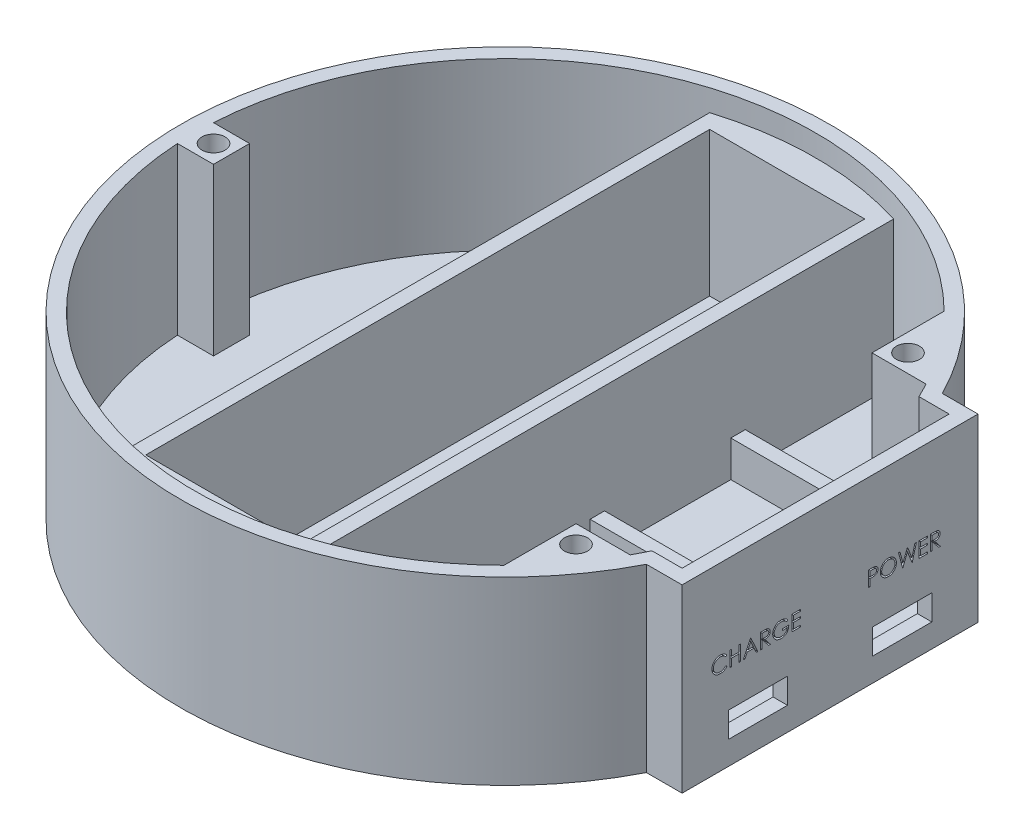
from build123d import *

# Parameters (mm, degrees)
BODY_DEPTH          = 25
SHELL1_T            = -2
SKETCH2_W           = 21.5
SKETCH2_H           = 78.132514876
BATTERY_CASE_DEPTH  = 20
USB_HOLE_REACH      = 105.682
SKETCH3_W           = 8.2
SKETCH3_H           = 3.5
SKETCH4_W           = 30.25
SKETCH4_H           = 2
PCB_PLACE_DEPTH     = 5
SKETCH5_R           = 1.6
FIXATION_HOLE_DEPTH = 23
CUT_EXTRUDE2_DEPTH  = 1


with BuildPart() as part:
    # Sketch1 → Body (new body)
    with BuildSketch(Plane(origin=(0, 0, 0), x_dir=(1, 0, 0), z_dir=(0, 1, 0))):
        with BuildLine():
            Line((40.059330998, 20.5), (45, 20.5))
            Line((45, 20.5), (45, -20.5))
            Line((45, -20.5), (40.059330998, -20.5))
            ThreePointArc((40.059330998, -20.5), (-45, 0), (40.059330998, 20.5))
        make_face()
    extrude(amount=BODY_DEPTH)

    # Shell1
    shell1_openings = [part.faces().sort_by_distance(p)[0] for p in [
        (0.446771334, 25, 0),
    ]]
    offset(amount=SHELL1_T, openings=shell1_openings, kind=Kind.INTERSECTION)

    # Sketch2 → Battery_Case (add)
    with BuildSketch(Plane(origin=(0, 2, 0), x_dir=(1, 0, 0), z_dir=(0, 1, 0))):
        with BuildLine():
            Line((-12.75, -41.066257438), (-12.75, 41.066257438))
            ThreePointArc((-12.75, 41.066257438), (0, 43), (12.75, 41.066257438))
            Line((12.75, 41.066257438), (12.75, -41.066257438))
            ThreePointArc((12.75, -41.066257438), (0, -43), (-12.75, -41.066257438))
        make_face()
        Rectangle(SKETCH2_W, SKETCH2_H, mode=Mode.SUBTRACT)
    extrude(amount=BATTERY_CASE_DEPTH)

    # Sketch3 → USB_Hole (cut, up to next)
    with BuildSketch(Plane(origin=(45, 0, 0), x_dir=(0, 0, -1), z_dir=(1, 0, 0)), mode=Mode.PRIVATE) as usb_hole_sk1:
        with Locations((-10, 5)):
            Rectangle(SKETCH3_W, SKETCH3_H)
    usb_hole_tool1 = extrude(usb_hole_sk1.sketch, amount=-USB_HOLE_REACH, mode=Mode.PRIVATE) & part.part
    # Sketch3 → USB_Hole (cut, up to next)
    with BuildSketch(Plane(origin=(45, 0, 0), x_dir=(0, 0, -1), z_dir=(1, 0, 0)), mode=Mode.PRIVATE) as usb_hole_sk2:
        with Locations((10, 5)):
            Rectangle(SKETCH3_W, SKETCH3_H)
    usb_hole_tool2 = extrude(usb_hole_sk2.sketch, amount=-USB_HOLE_REACH, mode=Mode.PRIVATE) & part.part
    add(usb_hole_tool1.solids().sort_by_distance((45, 5, 10))[0], mode=Mode.SUBTRACT)
    add(usb_hole_tool2.solids().sort_by_distance((45, 5, -10))[0], mode=Mode.SUBTRACT)

    # Sketch4 → PCB_Place (add)
    with BuildSketch(Plane(origin=(0, 2, 0), x_dir=(1, 0, 0), z_dir=(0, 1, 0))):
        with BuildLine():
            Line((38.816877772, 18.5), (12.75, 18.5))
            Line((12.75, 18.5), (12.75, 20.5))
            Line((12.75, 20.5), (37.798809505, 20.5))
            ThreePointArc((37.798809505, 20.5), (38.320893573, 19.506642862), (38.816877772, 18.5))
        make_face()
        with BuildLine():
            Line((38.816877772, -18.5), (12.75, -18.5))
            Line((12.75, -18.5), (12.75, -20.5))
            Line((12.75, -20.5), (37.798809505, -20.5))
            ThreePointArc((37.798809505, -20.5), (38.320893573, -19.506642862), (38.816877772, -18.5))
        make_face()
        with Locations((27.875, 0)):
            Rectangle(SKETCH4_W, SKETCH4_H)
    extrude(amount=PCB_PLACE_DEPTH)

    # Sketch5 → Fixation_Hole (add)
    # profile 1 of 3: a face of its own
    with BuildSketch(Plane(origin=(0, 2, 0), x_dir=(1, 0, 0), z_dir=(0, 1, 0))):
        with BuildLine():
            Line((-42.927264064, 2.5), (-37.927264064, 2.5))
            Line((-37.927264064, 2.5), (-37.927264064, -2.5))
            Line((-37.927264064, -2.5), (-42.927264064, -2.5))
            ThreePointArc((-42.927264064, -2.5), (-43, 0), (-42.927264064, 2.5))
        make_face()
        with Locations(Location((-40.427264064, 0, 0), (0, 0, 270))):
            Circle(SKETCH5_R, mode=Mode.SUBTRACT)
    # profile 2 of 3: a face of its own
    with BuildSketch(Plane(origin=(0, 2, 0), x_dir=(1, 0, 0), z_dir=(0, 1, 0))):
        with BuildLine():
            Line((37.798809505, 20.5), (30.310889132, 20.5))
            Line((30.310889132, 20.5), (30.310889132, 30.5))
            ThreePointArc((30.310889132, 30.5), (34.419947155, 25.773382352), (37.798809505, 20.5))
        make_face()
        with Locations(Location((32.798809505, 23, 0), (0, 0, 270))):
            Circle(SKETCH5_R, mode=Mode.SUBTRACT)
    # profile 3 of 3: a face of its own
    with BuildSketch(Plane(origin=(0, 2, 0), x_dir=(1, 0, 0), z_dir=(0, 1, 0))):
        with BuildLine():
            Line((37.798809505, -20.5), (30.310889132, -20.5))
            Line((30.310889132, -20.5), (30.310889132, -30.5))
            ThreePointArc((30.310889132, -30.5), (34.419947155, -25.773382352), (37.798809505, -20.5))
        make_face()
        with Locations(Location((32.798809505, -23, 0), (0, 0, 270))):
            Circle(SKETCH5_R, mode=Mode.SUBTRACT)
    extrude(amount=FIXATION_HOLE_DEPTH)

    # Sketch6 → Cut-Extrude2 (cut)
    # profile 1 of 11: a face of its own
    with BuildSketch(Plane(origin=(45, 0, 0), x_dir=(0, 0, -1), z_dir=(1, 0, 0))):
        with BuildLine():
            Line((-14.293376068, 13.478271902), (-14.459588675, 13.351068376))
            add(Edge.make_bspline(
                [(-14.459588675, 13.351068376), (-14.47144557, 13.365199224), (-14.494999502, 13.393270407), (-14.5328934, 13.432688512), (-14.572385346, 13.469618456), (-14.613460243, 13.504236164), (-14.656857425, 13.535331065), (-14.701525623, 13.56452359), (-14.748212059, 13.590690269), (-14.812771442, 13.622417885), (-14.89722514, 13.655526274), (-15.003539162, 13.683286799), (-15.114519684, 13.700958653), (-15.190234423, 13.702872629), (-15.228745994, 13.703846154)],
                knots=[0, 0, 0, 0, 0.757959112, 1.505699292, 2.245454638, 2.979532153, 3.711538275, 4.438200793, 5.171680507, 5.909471876, 7.393775596, 8.890124382, 10.418191784, 12, 12, 12, 12], degree=3))
            add(Edge.make_bspline(
                [(-15.228745994, 13.703846154), (-15.249963037, 13.703601853), (-15.292200208, 13.703115518), (-15.354882856, 13.696699523), (-15.416395035, 13.687681791), (-15.476696731, 13.674301239), (-15.535711187, 13.657384464), (-15.593824211, 13.637170047), (-15.650194431, 13.612160215), (-15.705601651, 13.584517601), (-15.758687174, 13.553295289), (-15.808915703, 13.519239119), (-15.856104046, 13.48273019), (-15.90028953, 13.443631663), (-15.941517327, 13.402119621), (-15.979488701, 13.357751662), (-16.014072259, 13.310669633), (-16.045953507, 13.261494382), (-16.07450597, 13.210369146), (-16.098412135, 13.157104698), (-16.119581899, 13.102613169), (-16.136333346, 13.046278896), (-16.149592459, 12.988498271), (-16.158741093, 12.929116223), (-16.165084121, 12.868256807), (-16.165568037, 12.827006413), (-16.165811966, 12.806213275)],
                knots=[0, 0, 0, 0, 1.054917814, 2.100044995, 3.131103042, 4.146048494, 5.169673617, 6.183595914, 7.203665975, 8.234915748, 9.262203917, 10.264457458, 11.251630812, 12.227803204, 13.197192746, 14.159520551, 15.12972552, 16.100847026, 17.073214652, 18.039054194, 19.002613845, 19.979014051, 20.95965708, 21.949030935, 22.966165397, 24, 24, 24, 24], degree=3))
            add(Edge.make_bspline(
                [(-16.165811966, 12.806213275), (-16.165048866, 12.774928143), (-16.16355062, 12.713503937), (-16.150216627, 12.623533139), (-16.129954025, 12.537342065), (-16.099585557, 12.455469494), (-16.062139274, 12.376905868), (-16.014822332, 12.302980466), (-15.960020903, 12.232576162), (-15.896959706, 12.167356856), (-15.827771427, 12.107779508), (-15.753538166, 12.055316061), (-15.674444811, 12.011582775), (-15.591364659, 11.975190655), (-15.50365839, 11.947216348), (-15.411483724, 11.927522807), (-15.315041136, 11.914676345), (-15.249140594, 11.913446448), (-15.215601629, 11.912820513)],
                knots=[0, 0, 0, 0, 1.029171465, 2.020641659, 2.987623507, 3.938342917, 4.889210282, 5.84687017, 6.821220943, 7.821438502, 8.827599549, 9.822697543, 10.807740252, 11.797342354, 12.80366471, 13.83203677, 14.896651826, 16, 16, 16, 16], degree=3))
            add(Edge.make_bspline(
                [(-15.215601629, 11.912820513), (-15.178649051, 11.913841822), (-15.105917536, 11.915852004), (-14.999256873, 11.932881645), (-14.897151433, 11.960493815), (-14.799595726, 11.999136844), (-14.706864774, 12.049371566), (-14.61881346, 12.110269806), (-14.535367463, 12.182410845), (-14.485189592, 12.237494451), (-14.459588675, 12.265598291)],
                knots=[0, 0, 0, 0, 1.028121516, 2.023589091, 2.998037872, 3.967518031, 4.937445131, 5.927275754, 6.942489185, 8, 8, 8, 8], degree=3))
            Line((-14.459588675, 12.265598291), (-14.293376068, 12.1396668))
            add(Edge.make_bspline(
                [(-14.293376068, 12.1396668), (-14.306752259, 12.122407832), (-14.333440568, 12.087972564), (-14.376655654, 12.039427292), (-14.422180496, 11.993765328), (-14.470353235, 11.951354814), (-14.520619709, 11.911347113), (-14.573882488, 11.874878863), (-14.62944138, 11.841441042), (-14.687108136, 11.810823807), (-14.746821487, 11.783659567), (-14.808509884, 11.760404193), (-14.871907422, 11.740371522), (-14.937017001, 11.723890589), (-15.003973673, 11.711026648), (-15.072535817, 11.70242713), (-15.142851408, 11.696535591), (-15.190289791, 11.695998614), (-15.214329594, 11.695726496)],
                knots=[0, 0, 0, 0, 0.986787822, 1.968848986, 2.935600012, 3.899624008, 4.868462664, 5.837806735, 6.815139263, 7.798259679, 8.787526145, 9.778297419, 10.776456485, 11.791383307, 12.812564526, 13.85620153, 14.913611965, 16, 16, 16, 16], degree=3))
            add(Edge.make_bspline(
                [(-15.214329594, 11.695726496), (-15.23709505, 11.695884939), (-15.28211092, 11.69619824), (-15.348573498, 11.701273504), (-15.413276721, 11.708197868), (-15.476035661, 11.718624043), (-15.537192798, 11.730927525), (-15.596193723, 11.747420142), (-15.653619017, 11.765895114), (-15.709237966, 11.787609082), (-15.76309788, 11.812111726), (-15.815025042, 11.839804716), (-15.86499557, 11.870455177), (-15.913500753, 11.903387493), (-15.959824054, 11.93965948), (-16.0043669, 11.978767397), (-16.047379064, 12.020579433), (-16.073990212, 12.050729749), (-16.087369792, 12.065888755)],
                knots=[0, 0, 0, 0, 1.114604814, 2.203992996, 3.262667896, 4.300477797, 5.318619304, 6.316056647, 7.298880507, 8.271930387, 9.238335007, 10.195173496, 11.151986948, 12.108099108, 13.064862484, 14.031167946, 15.010108607, 16, 16, 16, 16], degree=3))
            add(Edge.make_bspline(
                [(-16.087369792, 12.065888755), (-16.108799919, 12.092220808), (-16.15140145, 12.144567009), (-16.20590603, 12.229406626), (-16.252561933, 12.317985019), (-16.290284513, 12.410767547), (-16.319774357, 12.507546015), (-16.340203937, 12.608369207), (-16.353479431, 12.713142962), (-16.354997558, 12.784406163), (-16.355769231, 12.820629674)],
                knots=[0, 0, 0, 0, 0.994628077, 1.977248131, 2.950237994, 3.925870899, 4.908910175, 5.911660606, 6.938484602, 8, 8, 8, 8], degree=3))
            add(Edge.make_bspline(
                [(-16.355769231, 12.820629674), (-16.354828709, 12.858702734), (-16.352978291, 12.933609103), (-16.337257024, 13.043539065), (-16.311966609, 13.148859197), (-16.276045634, 13.24937289), (-16.230503826, 13.345608821), (-16.174244874, 13.436831836), (-16.107922364, 13.523625329), (-16.032056454, 13.604672345), (-15.94886097, 13.678779477), (-15.859768164, 13.743976562), (-15.764952415, 13.798234298), (-15.665458286, 13.84358912), (-15.560540755, 13.878450296), (-15.450423669, 13.902854366), (-15.335313945, 13.918044241), (-15.256778097, 13.919964486), (-15.216873665, 13.920940171)],
                knots=[0, 0, 0, 0, 1.032925535, 2.032216505, 3.007276963, 3.968222605, 4.92396291, 5.891752235, 6.871517503, 7.883894988, 8.900124299, 9.891468569, 10.874487609, 11.85992873, 12.854644235, 13.869047385, 14.917252991, 16, 16, 16, 16], degree=3))
            add(Edge.make_bspline(
                [(-15.216873665, 13.920940171), (-15.192553484, 13.920648592), (-15.144414136, 13.920071441), (-15.073201817, 13.914443441), (-15.003870505, 13.905061403), (-14.936372435, 13.892291208), (-14.870379234, 13.876442019), (-14.806395279, 13.855795267), (-14.74404512, 13.83218746), (-14.68372199, 13.804998292), (-14.625715315, 13.77447793), (-14.57004316, 13.740964672), (-14.517147746, 13.704500065), (-14.466656871, 13.66539424), (-14.419415162, 13.622819873), (-14.374081315, 13.577947994), (-14.332194854, 13.52948611), (-14.30633935, 13.495374555), (-14.293376068, 13.478271902)],
                knots=[0, 0, 0, 0, 1.096760587, 2.17092713, 3.219439832, 4.250915756, 5.268269357, 6.278326846, 7.281116186, 8.274029601, 9.260640565, 10.235837813, 11.203064059, 12.156899882, 13.114053108, 14.069676657, 15.032185724, 16, 16, 16, 16], degree=3))
        make_face()
    # profile 2 of 11: a face of its own
    with BuildSketch(Plane(origin=(45, 0, 0), x_dir=(0, 0, -1), z_dir=(1, 0, 0))):
        Polygon((-13.859188034, 13.866666667), (-13.669230769, 13.866666667), (-13.669230769, 12.998290598), (-12.583760684, 12.998290598), (-12.583760684, 13.866666667), (-12.393803419, 13.866666667), (-12.393803419, 11.75), (-12.583760684, 11.75), (-12.583760684, 12.781196581), (-13.669230769, 12.781196581), (-13.669230769, 11.75), (-13.859188034, 11.75), align=None)
    # profile 3 of 11: a face of its own
    with BuildSketch(Plane(origin=(45, 0, 0), x_dir=(0, 0, -1), z_dir=(1, 0, 0))):
        Polygon((-10.982692308, 13.866666667), (-10.005769231, 11.75), (-10.212262954, 11.75), (-10.525183627, 12.428418803), (-11.484722222, 12.428418803), (-11.806547142, 11.75), (-12.013888889, 11.75), (-11.00982906, 13.866666667), align=None)
        Polygon((-10.998380743, 13.454103232), (-11.381687366, 12.645512821), (-10.625250401, 12.645512821), align=None, mode=Mode.SUBTRACT)
    # profile 4 of 11: a face of its own
    with BuildSketch(Plane(origin=(45, 0, 0), x_dir=(0, 0, -1), z_dir=(1, 0, 0))):
        with BuildLine():
            Line((-9.625854701, 13.866666667), (-9.20226696, 13.866666667))
            add(Edge.make_bspline(
                [(-9.20226696, 13.866666667), (-9.173999707, 13.866572574), (-9.119723448, 13.866391906), (-9.041967232, 13.865384516), (-8.971314654, 13.862497168), (-8.907802656, 13.860012453), (-8.851432403, 13.855481612), (-8.802031041, 13.851151126), (-8.7598261, 13.845482293), (-8.734277419, 13.840217585), (-8.722709669, 13.837833868)],
                knots=[0, 0, 0, 0, 1.410062039, 2.707475311, 3.878576406, 4.937260626, 5.877586885, 6.699081471, 7.410979367, 8, 8, 8, 8], degree=3))
            add(Edge.make_bspline(
                [(-8.722709669, 13.837833868), (-8.707223758, 13.834007681), (-8.676582293, 13.82643693), (-8.632464872, 13.810435172), (-8.590425257, 13.791917589), (-8.550638078, 13.770168101), (-8.513302623, 13.745025258), (-8.47803393, 13.716923108), (-8.44467196, 13.686015417), (-8.414565926, 13.651522918), (-8.386178976, 13.615336076), (-8.362237283, 13.576205709), (-8.341598888, 13.535286595), (-8.325167194, 13.492162585), (-8.311936229, 13.447251894), (-8.302607027, 13.400147717), (-8.297012261, 13.351064651), (-8.296442663, 13.317586297), (-8.296153846, 13.300610978)],
                knots=[0, 0, 0, 0, 1.027469482, 2.033020251, 3.019912614, 3.986113645, 4.951240523, 5.91722682, 6.890402269, 7.87763091, 8.8651537, 9.85103654, 10.82876324, 11.815024772, 12.821070561, 13.842952187, 14.906261191, 16, 16, 16, 16], degree=3))
            add(Edge.make_bspline(
                [(-8.296153846, 13.300610978), (-8.29704224, 13.272407843), (-8.298775727, 13.217376222), (-8.314938052, 13.137510832), (-8.341412423, 13.063010628), (-8.37789365, 12.993969413), (-8.424351143, 12.931732975), (-8.480185659, 12.877068271), (-8.545428348, 12.831324134), (-8.606164173, 12.799602676), (-8.659815141, 12.779286964), (-8.703982906, 12.764992595), (-8.752162459, 12.753948454), (-8.803892181, 12.744054469), (-8.859387344, 12.736584635), (-8.918514939, 12.7311136), (-8.981317136, 12.727694246), (-9.024460287, 12.727185034), (-9.046654647, 12.726923077)],
                knots=[0, 0, 0, 0, 1.260483769, 2.459530307, 3.627416485, 4.787058657, 5.939039949, 7.08810263, 8.267026773, 9.491475466, 10.141966685, 10.831826277, 11.566392101, 12.351337768, 13.187381173, 14.07005841, 15.007169909, 16, 16, 16, 16], degree=3))
            Line((-9.046654647, 12.726923077), (-8.269017094, 11.75))
            Line((-8.269017094, 11.75), (-8.503919605, 11.75))
            Line((-8.503919605, 11.75), (-9.281557158, 12.726923077))
            Line((-9.281557158, 12.726923077), (-9.435897436, 12.726923077))
            Line((-9.435897436, 12.726923077), (-9.435897436, 11.75))
            Line((-9.435897436, 11.75), (-9.625854701, 11.75))
            Line((-9.625854701, 11.75), (-9.625854701, 13.866666667))
        make_face()
        with BuildLine():
            Line((-9.435897436, 13.64957265), (-9.435897436, 12.944017094))
            Line((-9.435897436, 12.944017094), (-9.048350694, 12.941049012))
            add(Edge.make_bspline(
                [(-9.048350694, 12.941049012), (-9.030256195, 12.941041007), (-8.995183901, 12.941025491), (-8.944443975, 12.943440774), (-8.897199907, 12.9461884), (-8.853632405, 12.9503911), (-8.813722004, 12.955807391), (-8.777488655, 12.962582529), (-8.744873209, 12.970475919), (-8.706834569, 12.982693093), (-8.66435819, 13.002049113), (-8.618195831, 13.030210153), (-8.578884894, 13.065630525), (-8.545672663, 13.10613352), (-8.518984864, 13.150665918), (-8.500169479, 13.198693913), (-8.488230002, 13.249005022), (-8.486821786, 13.283584163), (-8.486111111, 13.301034989)],
                knots=[0, 0, 0, 0, 1.146690395, 2.22261258, 3.21895312, 4.145990853, 4.996080663, 5.770904154, 6.481378293, 7.121626537, 8.300444488, 9.431385265, 10.535395872, 11.636531494, 12.74115979, 13.810798291, 14.895190096, 16, 16, 16, 16], degree=3))
            add(Edge.make_bspline(
                [(-8.486111111, 13.301034989), (-8.486838108, 13.318056965), (-8.488278751, 13.351788309), (-8.500040625, 13.401170693), (-8.51993087, 13.447777849), (-8.546735271, 13.49142018), (-8.579391903, 13.531035554), (-8.617684104, 13.564930737), (-8.660564865, 13.592900651), (-8.700643161, 13.610774014), (-8.736465756, 13.621732211), (-8.767568455, 13.62944363), (-8.802712063, 13.635639094), (-8.842067222, 13.640603017), (-8.885465922, 13.644869578), (-8.933127602, 13.647743273), (-8.984736035, 13.649444991), (-9.020505846, 13.649529106), (-9.039022436, 13.64957265)],
                knots=[0, 0, 0, 0, 1.101028733, 2.181837193, 3.264309656, 4.369019818, 5.486613113, 6.575447106, 7.666700264, 8.788928104, 9.402425223, 10.0903467, 10.862060571, 11.710948788, 12.657782767, 13.684531032, 14.801375019, 16, 16, 16, 16], degree=3))
            Line((-9.039022436, 13.64957265), (-9.435897436, 13.64957265))
        make_face(mode=Mode.SUBTRACT)
    # profile 5 of 11: a face of its own
    with BuildSketch(Plane(origin=(45, 0, 0), x_dir=(0, 0, -1), z_dir=(1, 0, 0))):
        with BuildLine():
            Line((-5.853846154, 13.505408654), (-6.016666667, 13.351068376))
            add(Edge.make_bspline(
                [(-6.016666667, 13.351068376), (-6.046129994, 13.378785136), (-6.10435408, 13.433557734), (-6.199277655, 13.504623907), (-6.298315662, 13.56550293), (-6.400951315, 13.615036701), (-6.504642917, 13.654559561), (-6.608014129, 13.682698008), (-6.710004624, 13.700642828), (-6.777839085, 13.702788747), (-6.81126469, 13.703846154)],
                knots=[0, 0, 0, 0, 1.08915593, 2.152340314, 3.188132944, 4.216796309, 5.218260357, 6.173443236, 7.099959455, 8, 8, 8, 8], degree=3))
            add(Edge.make_bspline(
                [(-6.81126469, 13.703846154), (-6.831775009, 13.703596021), (-6.872742451, 13.703096403), (-6.93359477, 13.696719664), (-6.993808879, 13.687548532), (-7.05327111, 13.67427892), (-7.112097079, 13.65746106), (-7.17008219, 13.636424137), (-7.227334609, 13.61189787), (-7.283315049, 13.583557231), (-7.337586686, 13.552424181), (-7.388844392, 13.517923397), (-7.437414876, 13.481160653), (-7.482385228, 13.441215537), (-7.524014127, 13.39844988), (-7.563292428, 13.353659214), (-7.598838697, 13.30561982), (-7.630946212, 13.25521556), (-7.659588714, 13.203331713), (-7.684872995, 13.150467666), (-7.706098377, 13.096798764), (-7.722892286, 13.04225766), (-7.736747776, 12.987266303), (-7.746495091, 12.931443925), (-7.751990394, 12.874730753), (-7.752940947, 12.836753363), (-7.753418803, 12.817661592)],
                knots=[0, 0, 0, 0, 1.02818874, 2.053710826, 3.065248034, 4.081641283, 5.106893873, 6.131558223, 7.173050175, 8.228653731, 9.27666206, 10.308777013, 11.325269123, 12.329503258, 13.32196095, 14.316845687, 15.314881793, 16.315733098, 17.311955233, 18.285320748, 19.252783886, 20.203351036, 21.145449891, 22.095197417, 23.042428769, 24, 24, 24, 24], degree=3))
            add(Edge.make_bspline(
                [(-7.753418803, 12.817661592), (-7.752961774, 12.798145431), (-7.752048963, 12.759166401), (-7.746206769, 12.700991891), (-7.735364452, 12.643681386), (-7.720869695, 12.587046562), (-7.70273844, 12.530990427), (-7.680136875, 12.475756004), (-7.653366726, 12.421345339), (-7.622380812, 12.368248685), (-7.588401536, 12.316527618), (-7.550335959, 12.267808288), (-7.509901225, 12.221441933), (-7.465624247, 12.178458018), (-7.41892481, 12.137706805), (-7.368407671, 12.100311037), (-7.315066183, 12.065550397), (-7.258818965, 12.033862978), (-7.20027633, 12.005554959), (-7.140249627, 11.980382412), (-7.078547091, 11.959651575), (-7.015492988, 11.942755674), (-6.951162485, 11.928906447), (-6.885229043, 11.919996804), (-6.818177453, 11.913531396), (-6.772978375, 11.913058672), (-6.750206998, 11.912820513)],
                knots=[0, 0, 0, 0, 0.93586088, 1.869166235, 2.799637598, 3.729985548, 4.670839027, 5.622275134, 6.589130586, 7.576015415, 8.568469353, 9.55398029, 10.53834874, 11.515998671, 12.510579167, 13.508179873, 14.527009472, 15.561807829, 16.601455013, 17.643573243, 18.680854198, 19.719860599, 20.772568776, 21.833555941, 22.908541556, 24, 24, 24, 24], degree=3))
            add(Edge.make_bspline(
                [(-6.750206998, 11.912820513), (-6.722763902, 11.913394176), (-6.668874925, 11.914520656), (-6.589659315, 11.923289878), (-6.51357841, 11.936985796), (-6.440845992, 11.957043267), (-6.371377584, 11.982626918), (-6.304918519, 12.013466985), (-6.24199204, 12.050746359), (-6.182408978, 12.092821984), (-6.12752249, 12.139700001), (-6.078020234, 12.190284981), (-6.034691771, 12.244331384), (-5.99689131, 12.301520884), (-5.965619886, 12.362326854), (-5.9399521, 12.426451308), (-5.920277205, 12.493923089), (-5.912200625, 12.540545172), (-5.908119658, 12.564102564)],
                knots=[0, 0, 0, 0, 1.13008108, 2.219097802, 3.278683437, 4.311054135, 5.322181354, 6.324827112, 7.324222904, 8.330512327, 9.32562643, 10.293043162, 11.24128371, 12.174520618, 13.111833804, 14.052305215, 15.015860969, 16, 16, 16, 16], degree=3))
            Line((-5.908119658, 12.564102564), (-6.613675214, 12.564102564))
            Line((-6.613675214, 12.564102564), (-6.613675214, 12.781196581))
            Line((-6.613675214, 12.781196581), (-5.718162393, 12.781196581))
            add(Edge.make_bspline(
                [(-5.718162393, 12.781196581), (-5.719194025, 12.740733481), (-5.721213116, 12.661539884), (-5.735375984, 12.546048339), (-5.75824597, 12.436966411), (-5.789488158, 12.33417922), (-5.82993178, 12.237832428), (-5.879142786, 12.147828214), (-5.937908783, 12.06474803), (-6.004136526, 11.987913633), (-6.078461738, 11.919376443), (-6.158876094, 11.859138566), (-6.245512451, 11.80839746), (-6.338288859, 11.767116012), (-6.436901597, 11.73489793), (-6.541578855, 11.712055119), (-6.65217868, 11.698369379), (-6.727977528, 11.696620783), (-6.766743456, 11.695726496)],
                knots=[0, 0, 0, 0, 1.140356446, 2.231883559, 3.274166699, 4.278491846, 5.25512956, 6.21435461, 7.1637429, 8.11826594, 9.068280886, 10.0076534, 10.945064095, 11.891975133, 12.864533718, 13.863980011, 14.907571808, 16, 16, 16, 16], degree=3))
            add(Edge.make_bspline(
                [(-6.766743456, 11.695726496), (-6.790637681, 11.696070679), (-6.837764793, 11.696749518), (-6.907367402, 11.701573914), (-6.975050915, 11.709000739), (-7.040805473, 11.720216123), (-7.104872947, 11.73395308), (-7.166933362, 11.75154362), (-7.22722313, 11.771905167), (-7.285835436, 11.795064931), (-7.342238281, 11.821899219), (-7.396682889, 11.85171981), (-7.449470212, 11.884372938), (-7.500240679, 11.920423306), (-7.549258821, 11.95960127), (-7.59620857, 12.001985355), (-7.641352763, 12.047445984), (-7.66963171, 12.079727576), (-7.683880876, 12.09599359)],
                knots=[0, 0, 0, 0, 1.107784379, 2.184907829, 3.233506516, 4.263428166, 5.276301166, 6.270063455, 7.25232949, 8.225834625, 9.190232166, 10.146266622, 11.1027726, 12.066435141, 13.031522626, 14.010570082, 14.99756817, 16, 16, 16, 16], degree=3))
            add(Edge.make_bspline(
                [(-7.683880876, 12.09599359), (-7.704555225, 12.121799175), (-7.745560751, 12.172982), (-7.798343255, 12.25498768), (-7.843338389, 12.339897377), (-7.879846549, 12.427947462), (-7.908353867, 12.519055576), (-7.928798601, 12.6131053), (-7.940777295, 12.710217743), (-7.942503006, 12.775934355), (-7.943376068, 12.809181357)],
                knots=[0, 0, 0, 0, 1.023165419, 2.029347347, 3.013907458, 3.994755782, 4.975994455, 5.96558838, 6.970761222, 8, 8, 8, 8], degree=3))
            add(Edge.make_bspline(
                [(-7.943376068, 12.809181357), (-7.943054191, 12.834077138), (-7.942414527, 12.883552291), (-7.934658144, 12.957005043), (-7.923529667, 13.029153557), (-7.907172639, 13.099938856), (-7.886552517, 13.169408213), (-7.86081779, 13.237593887), (-7.830854924, 13.304536114), (-7.79602941, 13.36977412), (-7.75727357, 13.432442217), (-7.715212246, 13.492288127), (-7.669248164, 13.54822199), (-7.620131942, 13.600952177), (-7.567277572, 13.649816242), (-7.511180206, 13.695266585), (-7.451796613, 13.737364173), (-7.388939971, 13.775445931), (-7.323548467, 13.809653453), (-7.255778847, 13.83964312), (-7.185651799, 13.864428268), (-7.113692705, 13.885458125), (-7.039356883, 13.901009662), (-6.963183773, 13.912287713), (-6.884776324, 13.920004837), (-6.831777392, 13.920625478), (-6.804904514, 13.920940171)],
                knots=[0, 0, 0, 0, 1.008945113, 2.00506715, 2.99143336, 3.967273523, 4.948097931, 5.927297278, 6.919902385, 7.919676788, 8.923139349, 9.905703106, 10.883022732, 11.856032218, 12.825136022, 13.798837087, 14.781400844, 15.773989409, 16.776158564, 17.77167057, 18.775803737, 19.789618931, 20.80898985, 21.851988756, 22.910860228, 24, 24, 24, 24], degree=3))
            add(Edge.make_bspline(
                [(-6.804904514, 13.920940171), (-6.782989005, 13.920589716), (-6.739533125, 13.919894806), (-6.674868516, 13.915078091), (-6.611203407, 13.907443648), (-6.548443399, 13.897025544), (-6.486802216, 13.882835598), (-6.426104256, 13.865854921), (-6.366261532, 13.846084152), (-6.307461591, 13.822505183), (-6.249309067, 13.795742276), (-6.191480621, 13.765617016), (-6.134173839, 13.731614275), (-6.07728934, 13.69363309), (-6.020468417, 13.652325784), (-5.9646098, 13.606510943), (-5.908365162, 13.557995277), (-5.872199303, 13.523111289), (-5.853846154, 13.505408654)],
                knots=[0, 0, 0, 0, 0.985871117, 1.954866573, 2.915460327, 3.869826059, 4.81536089, 5.759505086, 6.70452669, 7.649098992, 8.607881297, 9.583363685, 10.581137262, 11.603961102, 12.659522466, 13.73993555, 14.853081303, 16, 16, 16, 16], degree=3))
        make_face()
    # profile 6 of 11: a face of its own
    with BuildSketch(Plane(origin=(45, 0, 0), x_dir=(0, 0, -1), z_dir=(1, 0, 0))):
        Polygon((-5.283974359, 13.866666667), (-4.089957265, 13.866666667), (-4.089957265, 13.64957265), (-5.094017094, 13.64957265), (-5.094017094, 12.998290598), (-4.089957265, 12.998290598), (-4.089957265, 12.781196581), (-5.094017094, 12.781196581), (-5.094017094, 11.967094017), (-4.089957265, 11.967094017), (-4.089957265, 11.75), (-5.283974359, 11.75), align=None)
    # profile 7 of 11: a face of its own
    with BuildSketch(Plane(origin=(45, 0, 0), x_dir=(0, 0, -1), z_dir=(1, 0, 0))):
        with BuildLine():
            Line((5.338247863, 13.866666667), (5.753355369, 13.866666667))
            add(Edge.make_bspline(
                [(5.753355369, 13.866666667), (5.781906726, 13.866635282), (5.836612395, 13.866575147), (5.915059119, 13.864751944), (5.986305957, 13.862316754), (6.050199283, 13.858941037), (6.106935685, 13.854951671), (6.156258433, 13.84935639), (6.198555212, 13.843514211), (6.223898636, 13.837574599), (6.235456731, 13.834865785)],
                knots=[0, 0, 0, 0, 1.415646017, 2.712440637, 3.8905458, 4.950247383, 5.884950622, 6.709939814, 7.411656543, 8, 8, 8, 8], degree=3))
            add(Edge.make_bspline(
                [(6.235456731, 13.834865785), (6.250088058, 13.830861082), (6.279005945, 13.822946042), (6.320674671, 13.807092981), (6.360319139, 13.788295671), (6.398075367, 13.766872622), (6.433479389, 13.741904686), (6.467059423, 13.714403974), (6.498519126, 13.683735549), (6.527681586, 13.650243387), (6.554463345, 13.614489737), (6.577522725, 13.575940864), (6.596831095, 13.535245647), (6.613391455, 13.492432392), (6.625310377, 13.447141578), (6.634289216, 13.399687899), (6.639988267, 13.350076444), (6.640534102, 13.316173572), (6.640811966, 13.298914931)],
                knots=[0, 0, 0, 0, 0.999701418, 1.975846123, 2.934577507, 3.890451536, 4.834027766, 5.787354733, 6.749476667, 7.726910423, 8.712836071, 9.690891519, 10.682875813, 11.679750201, 12.712814741, 13.765529915, 14.8625177, 16, 16, 16, 16], degree=3))
            add(Edge.make_bspline(
                [(6.640811966, 13.298914931), (6.640557104, 13.281511227), (6.64005845, 13.247459707), (6.634073554, 13.197643783), (6.626011962, 13.150037899), (6.613616125, 13.104747612), (6.597380885, 13.062041884), (6.578335691, 13.021268092), (6.555364699, 12.983119909), (6.528969969, 12.947458843), (6.499607814, 12.91425142), (6.467402466, 12.883738282), (6.432483941, 12.856098039), (6.394963213, 12.831268727), (6.354474495, 12.80982612), (6.31163186, 12.790620511), (6.266062919, 12.77449087), (6.234529113, 12.766006023), (6.218496261, 12.761692041)],
                knots=[0, 0, 0, 0, 1.121902311, 2.195077645, 3.232258892, 4.234102512, 5.217864754, 6.176164875, 7.132989551, 8.084763148, 9.034132444, 9.988522005, 10.94243251, 11.903244335, 12.886203696, 13.894208494, 14.929344452, 16, 16, 16, 16], degree=3))
            add(Edge.make_bspline(
                [(6.218496261, 12.761692041), (6.205235444, 12.758872047), (6.176173595, 12.752691868), (6.128311091, 12.745792468), (6.072585072, 12.739903538), (6.009071598, 12.735488088), (5.937827679, 12.731708103), (5.858814776, 12.728703589), (5.771877787, 12.727052678), (5.711237558, 12.726967532), (5.679577324, 12.726923077)],
                knots=[0, 0, 0, 0, 0.601384939, 1.31797006, 2.144135048, 3.087295005, 4.142315834, 5.309527816, 6.595305764, 8, 8, 8, 8], degree=3))
            Line((5.679577324, 12.726923077), (5.528205128, 12.726923077))
            Line((5.528205128, 12.726923077), (5.528205128, 11.75))
            Line((5.528205128, 11.75), (5.338247863, 11.75))
            Line((5.338247863, 11.75), (5.338247863, 13.866666667))
        make_face()
        with BuildLine():
            Line((5.528205128, 13.64957265), (5.528205128, 12.944017094))
            Line((5.528205128, 12.944017094), (5.8987914, 12.939352965))
            add(Edge.make_bspline(
                [(5.8987914, 12.939352965), (5.916885831, 12.939343613), (5.951816758, 12.93932556), (6.002275807, 12.941735671), (6.049089995, 12.944517898), (6.092115524, 12.948591528), (6.131371789, 12.954349621), (6.166924247, 12.960162434), (6.198497223, 12.968571868), (6.235447692, 12.979894867), (6.276621907, 12.999206496), (6.321415139, 13.027237144), (6.359376398, 13.062966906), (6.392226035, 13.103139928), (6.418294828, 13.147831306), (6.43737869, 13.195649187), (6.448591675, 13.246103172), (6.450095231, 13.280627903), (6.450854701, 13.298066907)],
                knots=[0, 0, 0, 0, 1.160613943, 2.240541288, 3.23993089, 4.169200891, 5.011653406, 5.7853311, 6.478053781, 7.106038997, 8.262395093, 9.384106736, 10.481365981, 11.59014053, 12.70357646, 13.786202915, 14.881775077, 16, 16, 16, 16], degree=3))
            add(Edge.make_bspline(
                [(6.450854701, 13.298066907), (6.4500911, 13.315084008), (6.448573157, 13.348911899), (6.437290802, 13.39848953), (6.418331931, 13.445803504), (6.392051038, 13.489934846), (6.360155212, 13.529963313), (6.323083704, 13.564735385), (6.28092378, 13.59268851), (6.24170604, 13.610730542), (6.206871037, 13.621746447), (6.176613614, 13.629454041), (6.142450206, 13.63560786), (6.104369691, 13.640590797), (6.062667225, 13.644856462), (6.01698453, 13.647750839), (5.96749466, 13.649445053), (5.933137791, 13.649529088), (5.915327858, 13.64957265)],
                knots=[0, 0, 0, 0, 1.120700087, 2.227813068, 3.331159281, 4.466773991, 5.599788987, 6.693661531, 7.80175334, 8.91857717, 9.525282508, 10.207424825, 10.974604443, 11.810962634, 12.737642355, 13.736264703, 14.826523623, 16, 16, 16, 16], degree=3))
            Line((5.915327858, 13.64957265), (5.528205128, 13.64957265))
        make_face(mode=Mode.SUBTRACT)
    # profile 8 of 11: a face of its own
    with BuildSketch(Plane(origin=(45, 0, 0), x_dir=(0, 0, -1), z_dir=(1, 0, 0))):
        with BuildLine():
            add(Edge.make_bspline(
                [(8.065491453, 13.920940171), (8.104684927, 13.919947467), (8.181664142, 13.917997714), (8.294799914, 13.903072732), (8.402807424, 13.877252187), (8.506566508, 13.842863621), (8.60483607, 13.796989779), (8.698355781, 13.741542094), (8.786903128, 13.675939664), (8.869284631, 13.600689608), (8.944672405, 13.518814852), (9.011090917, 13.431440116), (9.06675459, 13.339093698), (9.112465995, 13.2420531), (9.148327535, 13.140537786), (9.173073814, 13.034006556), (9.188881171, 12.923149653), (9.190729189, 12.847538168), (9.191666667, 12.809181357)],
                knots=[0, 0, 0, 0, 1.065120563, 2.091984664, 3.0946048, 4.079830382, 5.057816894, 6.036188127, 7.030412546, 8.04752943, 9.064399622, 10.05169764, 11.02544977, 11.989514704, 12.962713494, 13.945757189, 14.957906945, 16, 16, 16, 16], degree=3))
            add(Edge.make_bspline(
                [(9.191666667, 12.809181357), (9.190729327, 12.771107092), (9.188881721, 12.696058304), (9.173055841, 12.585904888), (9.148235807, 12.480016705), (9.112799018, 12.378570524), (9.067305514, 12.281459331), (9.011271196, 12.188938649), (8.94526675, 12.100978148), (8.870151178, 12.018541441), (8.788265786, 11.942947732), (8.700436053, 11.877077746), (8.608637236, 11.820396965), (8.511688032, 11.775170648), (8.4108742, 11.739022868), (8.305293462, 11.71437723), (8.195440545, 11.698479827), (8.120528081, 11.696654344), (8.082451923, 11.695726496)],
                knots=[0, 0, 0, 0, 1.043624062, 2.057103931, 3.04512605, 4.022047818, 4.998200453, 5.980619268, 6.982898556, 8.009068085, 9.034988726, 10.034168286, 11.015286542, 11.987931943, 12.962482838, 13.94673481, 14.956375938, 16, 16, 16, 16], degree=3))
            add(Edge.make_bspline(
                [(8.082451923, 11.695726496), (8.044095311, 11.696663506), (7.968484219, 11.698510602), (7.857488012, 11.714344119), (7.750881947, 11.739103859), (7.648970887, 11.774488137), (7.551698001, 11.820218558), (7.458873047, 11.875980254), (7.37086861, 11.942145525), (7.288414316, 12.017236739), (7.212970753, 12.098983344), (7.147197226, 12.186573584), (7.091422991, 12.278289027), (7.045846118, 12.374384197), (7.009763326, 12.474394545), (6.985146603, 12.578987196), (6.969219622, 12.687565849), (6.967384262, 12.761493697), (6.966452991, 12.799005075)],
                knots=[0, 0, 0, 0, 1.053102029, 2.075944431, 3.073151272, 4.055350789, 5.033113405, 6.020478099, 7.024410459, 8.052272461, 9.079885166, 10.07527673, 11.055994387, 12.023226415, 12.992069828, 13.970394897, 14.97016774, 16, 16, 16, 16], degree=3))
            add(Edge.make_bspline(
                [(6.966452991, 12.799005075), (6.966776319, 12.824182927), (6.967418894, 12.874221002), (6.975154822, 12.948526041), (6.986380232, 13.021636105), (7.002468055, 13.093343298), (7.02350873, 13.163472084), (7.048335433, 13.232506116), (7.078658101, 13.299745797), (7.112936398, 13.365509658), (7.151194729, 13.428772534), (7.19345292, 13.488571139), (7.238226691, 13.545407266), (7.287311219, 13.597808073), (7.339088784, 13.647297951), (7.394399327, 13.693116356), (7.452905351, 13.735676445), (7.5148586, 13.774030651), (7.578732509, 13.808719271), (7.644577036, 13.838486771), (7.711497915, 13.86403558), (7.779808583, 13.884743127), (7.849327641, 13.901091072), (7.920206815, 13.912223139), (7.99238964, 13.919978797), (8.041019342, 13.920618334), (8.065491453, 13.920940171)],
                knots=[0, 0, 0, 0, 1.037015668, 2.060948919, 3.074880161, 4.083647147, 5.086022904, 6.090072063, 7.104153813, 8.122640571, 9.144368836, 10.147691507, 11.138137339, 12.123020368, 13.103399296, 14.087645067, 15.080126199, 16.082011238, 17.087798457, 18.072939717, 19.057185487, 20.037253025, 21.01195951, 21.997135196, 22.992090687, 24, 24, 24, 24], degree=3))
        make_face()
        with BuildLine():
            add(Edge.make_bspline(
                [(8.074819712, 13.703846154), (8.054732766, 13.703601292), (8.014750909, 13.703113908), (7.955312166, 13.696693928), (7.896655139, 13.687543947), (7.838767715, 13.674492266), (7.781892102, 13.656709815), (7.72549815, 13.636244123), (7.670100113, 13.611315177), (7.615880875, 13.58314978), (7.563317949, 13.551974956), (7.513719791, 13.517520602), (7.466958002, 13.480594715), (7.423147074, 13.441111118), (7.382415651, 13.398868739), (7.343962046, 13.35450798), (7.309327584, 13.306760884), (7.277586307, 13.25692221), (7.249181946, 13.205056873), (7.223923851, 13.151710908), (7.20326276, 13.096449164), (7.186412656, 13.039871174), (7.172442771, 12.982066543), (7.163592731, 12.922596768), (7.157102209, 12.861760677), (7.156642683, 12.820647841), (7.156410256, 12.799853098)],
                knots=[0, 0, 0, 0, 1.008559885, 2.007477868, 2.99961109, 3.989939068, 4.984837346, 5.991145699, 7.001802488, 8.033829008, 9.059044045, 10.069351652, 11.065060232, 12.050310815, 13.029377138, 14.011219647, 14.996725999, 15.989392538, 16.977580475, 17.965360261, 18.951710183, 19.937753436, 20.929683414, 21.935841486, 22.955955122, 24, 24, 24, 24], degree=3))
            add(Edge.make_bspline(
                [(7.156410256, 12.799853098), (7.157181244, 12.769274993), (7.158698016, 12.709118401), (7.171977118, 12.620963381), (7.19243136, 12.536243322), (7.222583196, 12.455421786), (7.260290472, 12.377804053), (7.306873401, 12.304078676), (7.362063419, 12.234225728), (7.424755171, 12.168732875), (7.493288427, 12.108954698), (7.566061078, 12.056483494), (7.642293498, 12.012087771), (7.722184482, 11.975919942), (7.805307518, 11.947260434), (7.892198227, 11.927618595), (7.982277791, 11.914691534), (8.043679663, 11.913450105), (8.074819712, 11.912820513)],
                knots=[0, 0, 0, 0, 1.032063989, 2.030389145, 3.003944642, 3.970395727, 4.937377036, 5.913328081, 6.909231446, 7.93887556, 8.970685674, 9.976071282, 10.964166581, 11.944589148, 12.933237628, 13.927779006, 14.949070134, 16, 16, 16, 16], degree=3))
            add(Edge.make_bspline(
                [(8.074819712, 11.912820513), (8.09575022, 11.91310808), (8.137261704, 11.913678411), (8.199005186, 11.919422849), (8.259636324, 11.928634504), (8.319070074, 11.941897329), (8.377238984, 11.958496353), (8.434385841, 11.978216265), (8.48990195, 12.002818707), (8.544487661, 12.030001516), (8.596736817, 12.060989611), (8.646614877, 12.094274588), (8.692864636, 12.131146087), (8.736642789, 12.17004305), (8.777541439, 12.211749758), (8.815284015, 12.256211987), (8.849743428, 12.303710385), (8.881472653, 12.353473463), (8.909777483, 12.405480721), (8.934439129, 12.459020098), (8.955361541, 12.513959759), (8.972251637, 12.570378947), (8.985487131, 12.628170508), (8.994606892, 12.687411822), (9.000986186, 12.747984377), (9.001467018, 12.78895328), (9.001709402, 12.809605369)],
                knots=[0, 0, 0, 0, 1.047197238, 2.076906641, 3.100256066, 4.114471768, 5.12198147, 6.126382909, 7.136867548, 8.15857795, 9.17633901, 10.174870724, 11.156907918, 12.133735059, 13.104061851, 14.077631395, 15.04955518, 16.038496417, 17.029181396, 18.010275684, 18.986308667, 19.968651475, 20.955262928, 21.950658345, 22.966943676, 24, 24, 24, 24], degree=3))
            add(Edge.make_bspline(
                [(9.001709402, 12.809605369), (9.001466824, 12.830116174), (9.000985626, 12.870803133), (8.994609939, 12.930953247), (8.985477496, 12.989768285), (8.972316239, 13.047017347), (8.955352575, 13.102715026), (8.934435475, 13.156809012), (8.909770079, 13.209500825), (8.881462248, 13.260660233), (8.849642203, 13.309751622), (8.814871875, 13.356682605), (8.776550926, 13.400571834), (8.735774235, 13.442502816), (8.691523271, 13.481581254), (8.643998483, 13.517820112), (8.593776831, 13.552093949), (8.540601788, 13.583012741), (8.485723302, 13.61156611), (8.429411527, 13.636029336), (8.372304405, 13.656816284), (8.314547156, 13.674546068), (8.255653641, 13.687492829), (8.196021802, 13.696702174), (8.13573414, 13.703111674), (8.095188955, 13.70360055), (8.074819712, 13.703846154)],
                knots=[0, 0, 0, 0, 1.02996197, 2.043119294, 3.035359645, 4.018872909, 4.991431989, 5.957985074, 6.929999688, 7.912076566, 8.892894881, 9.867085534, 10.843653904, 11.817741046, 12.803660682, 13.806313499, 14.818574707, 15.856120519, 16.894564902, 17.924820532, 18.937903209, 19.946497019, 20.957711757, 21.963978472, 22.977135795, 24, 24, 24, 24], degree=3))
        make_face(mode=Mode.SUBTRACT)
    # profile 9 of 11: a face of its own
    with BuildSketch(Plane(origin=(45, 0, 0), x_dir=(0, 0, -1), z_dir=(1, 0, 0))):
        Polygon((9.49017094, 13.866666667), (9.686488381, 13.866666667), (10.100747863, 12.314359642), (10.716836939, 13.866666667), (10.744397703, 13.866666667), (11.349038462, 12.324959936), (11.765418002, 13.866666667), (11.959615385, 13.866666667), (11.388895566, 11.75), (11.361758814, 11.75), (10.724893162, 13.36887687), (10.080395299, 11.75), (10.053258547, 11.75), align=None)
    # profile 10 of 11: a face of its own
    with BuildSketch(Plane(origin=(45, 0, 0), x_dir=(0, 0, -1), z_dir=(1, 0, 0))):
        Polygon((12.339529915, 13.866666667), (13.533547009, 13.866666667), (13.533547009, 13.64957265), (12.529487179, 13.64957265), (12.529487179, 12.998290598), (13.533547009, 12.998290598), (13.533547009, 12.781196581), (12.529487179, 12.781196581), (12.529487179, 11.967094017), (13.533547009, 11.967094017), (13.533547009, 11.75), (12.339529915, 11.75), align=None)
    # profile 11 of 11: a face of its own
    with BuildSketch(Plane(origin=(45, 0, 0), x_dir=(0, 0, -1), z_dir=(1, 0, 0))):
        with BuildLine():
            Line((13.913461538, 13.866666667), (14.337049279, 13.866666667))
            add(Edge.make_bspline(
                [(14.337049279, 13.866666667), (14.365316533, 13.866572574), (14.419592792, 13.866391906), (14.497349007, 13.865384516), (14.568001585, 13.862497168), (14.631513583, 13.860012453), (14.687883836, 13.855481612), (14.737285198, 13.851151126), (14.779490139, 13.845482293), (14.80503882, 13.840217585), (14.816606571, 13.837833868)],
                knots=[0, 0, 0, 0, 1.410062039, 2.707475311, 3.878576406, 4.937260626, 5.877586885, 6.699081471, 7.410979367, 8, 8, 8, 8], degree=3))
            add(Edge.make_bspline(
                [(14.816606571, 13.837833868), (14.832092481, 13.834007681), (14.862733946, 13.82643693), (14.906851367, 13.810435172), (14.948890982, 13.791917589), (14.988678162, 13.770168101), (15.026013616, 13.745025258), (15.061282309, 13.716923108), (15.09464428, 13.686015417), (15.124750313, 13.651522918), (15.153137264, 13.615336076), (15.177078957, 13.576205709), (15.197717352, 13.535286595), (15.214149045, 13.492162585), (15.22738001, 13.447251894), (15.236709212, 13.400147717), (15.242303978, 13.351064651), (15.242873576, 13.317586297), (15.243162393, 13.300610978)],
                knots=[0, 0, 0, 0, 1.027469482, 2.033020251, 3.019912614, 3.986113645, 4.951240523, 5.91722682, 6.890402269, 7.87763091, 8.8651537, 9.85103654, 10.82876324, 11.815024772, 12.821070561, 13.842952187, 14.906261191, 16, 16, 16, 16], degree=3))
            add(Edge.make_bspline(
                [(15.243162393, 13.300610978), (15.242273999, 13.272407843), (15.240540512, 13.217376222), (15.224378187, 13.137510832), (15.197903816, 13.063010628), (15.161422589, 12.993969413), (15.114965096, 12.931732975), (15.05913058, 12.877068271), (14.993887891, 12.831324134), (14.933152067, 12.799602676), (14.879501098, 12.779286964), (14.835333333, 12.764992595), (14.78715378, 12.753948454), (14.735424058, 12.744054469), (14.679928895, 12.736584635), (14.6208013, 12.7311136), (14.557999104, 12.727694246), (14.514855952, 12.727185034), (14.492661592, 12.726923077)],
                knots=[0, 0, 0, 0, 1.260483769, 2.459530307, 3.627416485, 4.787058657, 5.939039949, 7.08810263, 8.267026773, 9.491475466, 10.141966685, 10.831826277, 11.566392101, 12.351337768, 13.187381173, 14.07005841, 15.007169909, 16, 16, 16, 16], degree=3))
            Line((14.492661592, 12.726923077), (15.270299145, 11.75))
            Line((15.270299145, 11.75), (15.035396635, 11.75))
            Line((15.035396635, 11.75), (14.257759081, 12.726923077))
            Line((14.257759081, 12.726923077), (14.103418803, 12.726923077))
            Line((14.103418803, 12.726923077), (14.103418803, 11.75))
            Line((14.103418803, 11.75), (13.913461538, 11.75))
            Line((13.913461538, 11.75), (13.913461538, 13.866666667))
        make_face()
        with BuildLine():
            Line((14.103418803, 13.64957265), (14.103418803, 12.944017094))
            Line((14.103418803, 12.944017094), (14.490965545, 12.941049012))
            add(Edge.make_bspline(
                [(14.490965545, 12.941049012), (14.509060045, 12.941041007), (14.544132339, 12.941025491), (14.594872265, 12.943440774), (14.642116332, 12.9461884), (14.685683835, 12.9503911), (14.725594235, 12.955807391), (14.761827585, 12.962582529), (14.79444303, 12.970475919), (14.83248167, 12.982693093), (14.874958049, 13.002049113), (14.921120408, 13.030210153), (14.960431346, 13.065630525), (14.993643577, 13.10613352), (15.020331376, 13.150665918), (15.039146761, 13.198693913), (15.051086238, 13.249005022), (15.052494453, 13.283584163), (15.053205128, 13.301034989)],
                knots=[0, 0, 0, 0, 1.146690395, 2.22261258, 3.21895312, 4.145990853, 4.996080663, 5.770904154, 6.481378293, 7.121626537, 8.300444488, 9.431385265, 10.535395872, 11.636531494, 12.74115979, 13.810798291, 14.895190096, 16, 16, 16, 16], degree=3))
            add(Edge.make_bspline(
                [(15.053205128, 13.301034989), (15.052478131, 13.318056965), (15.051037488, 13.351788309), (15.039275614, 13.401170693), (15.019385369, 13.447777849), (14.992580968, 13.49142018), (14.959924336, 13.531035554), (14.921632135, 13.564930737), (14.878751374, 13.592900651), (14.838673078, 13.610774014), (14.802850483, 13.621732211), (14.771747784, 13.62944363), (14.736604176, 13.635639094), (14.697249018, 13.640603017), (14.653850317, 13.644869578), (14.606188638, 13.647743273), (14.554580204, 13.649444991), (14.518810393, 13.649529106), (14.500293803, 13.64957265)],
                knots=[0, 0, 0, 0, 1.101028733, 2.181837193, 3.264309656, 4.369019818, 5.486613113, 6.575447106, 7.666700264, 8.788928104, 9.402425223, 10.0903467, 10.862060571, 11.710948788, 12.657782767, 13.684531032, 14.801375019, 16, 16, 16, 16], degree=3))
            Line((14.500293803, 13.64957265), (14.103418803, 13.64957265))
        make_face(mode=Mode.SUBTRACT)
    extrude(amount=-CUT_EXTRUDE2_DEPTH, mode=Mode.SUBTRACT)


solid = part.part
